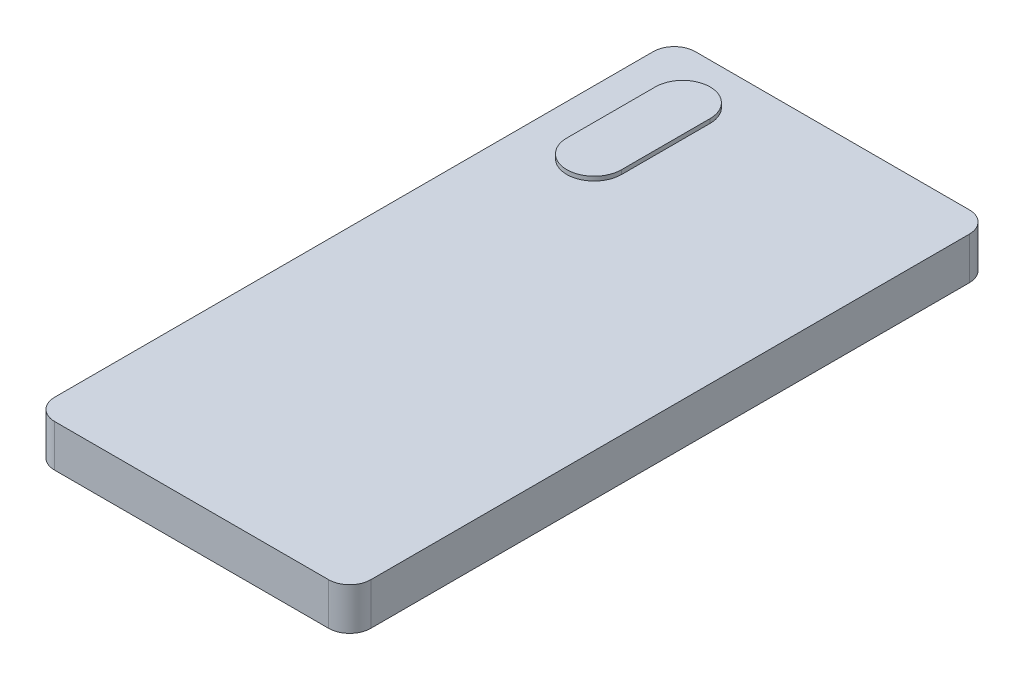
from build123d import *

# Parameters (mm, degrees)
EXTRUDE_1_DEPTH = 10
EXTRUDE_2_DEPTH = 1


with BuildPart() as part:
    # 草图1 → 凸台-拉伸1 (new body)
    with BuildSketch(Plane(origin=(0, 0, 0), x_dir=(1, 0, 0), z_dir=(0, 1, 0))):
        with BuildLine():
            Line((-32.5, 76), (32.5, 76))
            ThreePointArc((32.5, 76), (36.035533906, 74.535533906), (37.5, 71))
            Line((37.5, 71), (37.5, -71))
            ThreePointArc((37.5, -71), (36.035533906, -74.535533906), (32.5, -76))
            Line((32.5, -76), (-32.5, -76))
            ThreePointArc((-32.5, -76), (-36.035533906, -74.535533906), (-37.5, -71))
            Line((-37.5, -71), (-37.5, 71))
            ThreePointArc((-37.5, 71), (-36.035533906, 74.535533906), (-32.5, 76))
        make_face()
    extrude(amount=EXTRUDE_1_DEPTH)

    # 草图2 → 凸台-拉伸2 (add)
    with BuildSketch(Plane(origin=(0, 10, 0), x_dir=(1, 0, 0), z_dir=(0, 1, 0))):
        with BuildLine():
            Line((-29, 63), (-29, 42))
            ThreePointArc((-29, 42), (-22.5, 35.5), (-16, 42))
            Line((-16, 42), (-16, 63))
            ThreePointArc((-16, 63), (-22.5, 69.5), (-29, 63))
        make_face()
    extrude(amount=EXTRUDE_2_DEPTH)


solid = part.part
